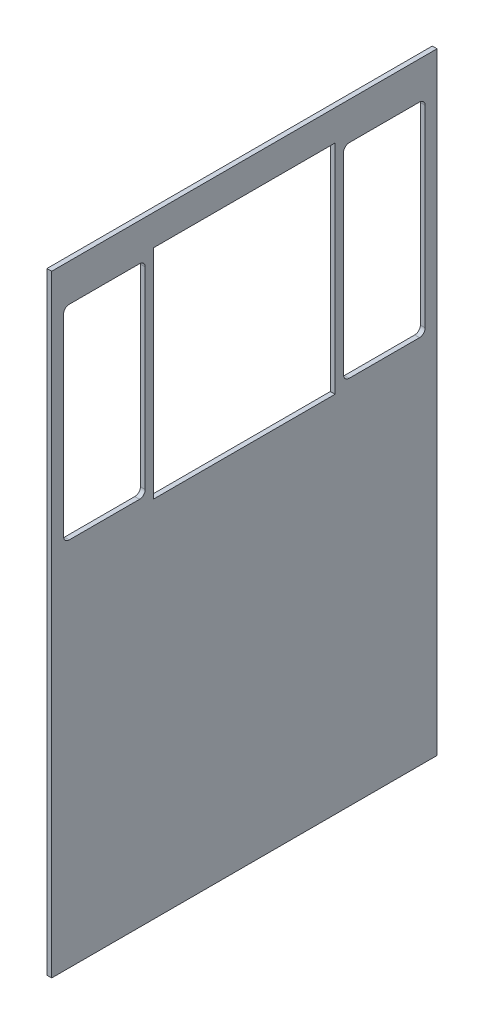
from build123d import *

# Parameters (mm, degrees)
SKETCH1_W                   = 228.6
SKETCH1_H                   = 349.25
SKETCH1_W_2                 = 101.6
SKETCH1_H_2                 = 121.92
BOSS_EXTRUDE1_DEPTH         = 2.667
CORNERRADIUSALLOWANCE_DEPTH = 368.487639777


with BuildPart() as part:
    # Sketch1 → Boss-Extrude1 (new body)
    with BuildSketch(Plane(origin=(0, 0, 0), x_dir=(0, 0, -1), z_dir=(1, 0, 0))):
        with Locations((0, 174.625)):
            Rectangle(SKETCH1_W, SKETCH1_H)
        with BuildLine():
            Line((98.1075, 207.645), (58.7375, 207.645))
            ThreePointArc((58.7375, 207.645), (56.49243597, 208.57493597), (55.5625, 210.82))
            Line((55.5625, 210.82), (55.5625, 318.77))
            ThreePointArc((55.5625, 318.77), (56.49243597, 321.01506403), (58.7375, 321.945))
            Line((58.7375, 321.945), (98.1075, 321.945))
            ThreePointArc((98.1075, 321.945), (100.35256403, 321.01506403), (101.2825, 318.77))
            Line((101.2825, 318.77), (101.2825, 210.82))
            ThreePointArc((101.2825, 210.82), (100.35256403, 208.57493597), (98.1075, 207.645))
        make_face(mode=Mode.SUBTRACT)
        with Locations((0, 264.795)):
            Rectangle(SKETCH1_W_2, SKETCH1_H_2, mode=Mode.SUBTRACT)
        with BuildLine():
            Line((-98.1075, 207.645), (-58.7375, 207.645))
            ThreePointArc((-58.7375, 207.645), (-56.49243597, 208.57493597), (-55.5625, 210.82))
            Line((-55.5625, 210.82), (-55.5625, 318.77))
            ThreePointArc((-55.5625, 318.77), (-56.49243597, 321.01506403), (-58.7375, 321.945))
            Line((-58.7375, 321.945), (-98.1075, 321.945))
            ThreePointArc((-98.1075, 321.945), (-100.35256403, 321.01506403), (-101.2825, 318.77))
            Line((-101.2825, 318.77), (-101.2825, 210.82))
            ThreePointArc((-101.2825, 210.82), (-100.35256403, 208.57493597), (-98.1075, 207.645))
        make_face(mode=Mode.SUBTRACT)
    extrude(amount=BOSS_EXTRUDE1_DEPTH)

    # Sketch2 → CornerRadiusAllowance (cut, through all)
    with BuildSketch(Plane(origin=(2.667, 0, 0), x_dir=(0, 0, -1), z_dir=(1, 0, 0))):
        Polygon((114.3, 349.25), (-114.3, 349.25), (-114.3, 0), (-107.95, 0), (-107.95, 342.9), (107.95, 342.9), (107.95, 0), (114.3, 0), align=None)
    extrude(amount=-CORNERRADIUSALLOWANCE_DEPTH, mode=Mode.SUBTRACT)


solid = part.part
